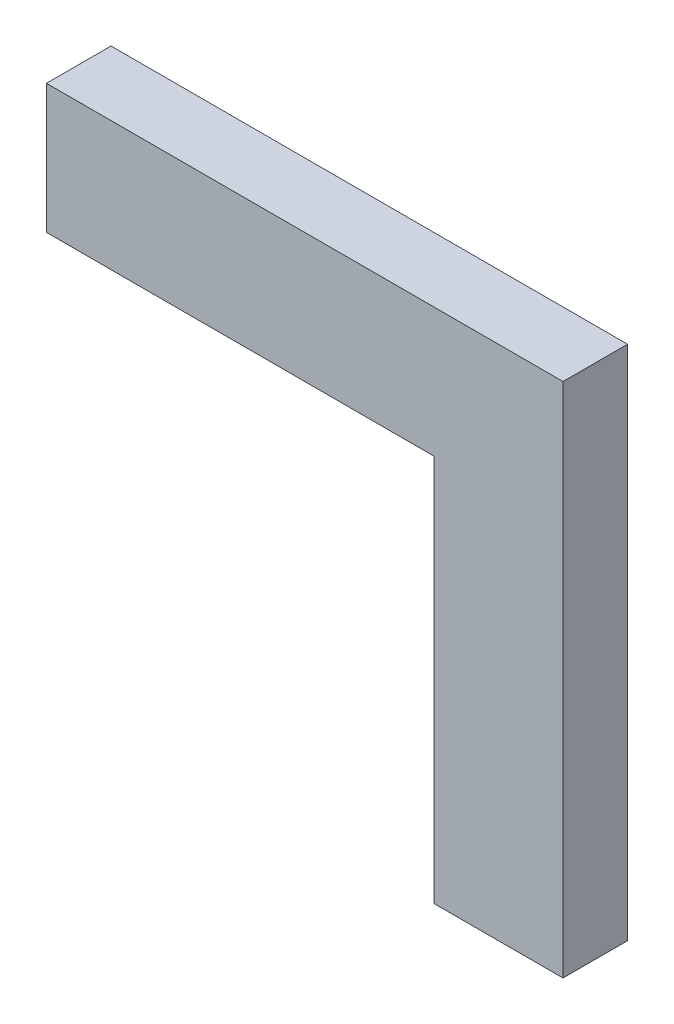
from build123d import *

# Parameters (mm, degrees)
BOSS_EXTRUDE1_DEPTH = 25.4


with BuildPart() as part:
    # Sketch3 → Boss-Extrude1 (new body)
    with BuildSketch(Plane.XY):
        Polygon((-76.2, 25.4), (76.2, 25.4), (127, 25.4), (127, -177.8), (76.2, -177.8), (76.2, -25.4), (-76.2, -25.4), align=None)
    extrude(amount=BOSS_EXTRUDE1_DEPTH)


solid = part.part
